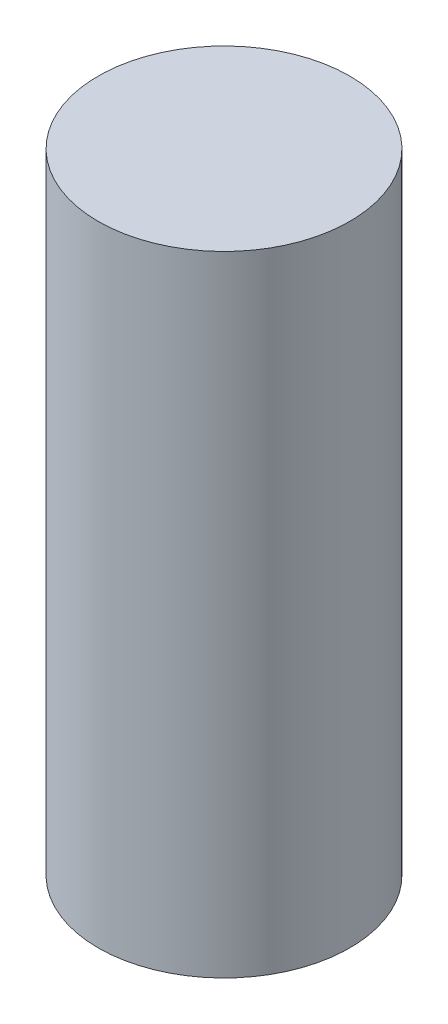
from build123d import *

# Parameters (mm, degrees)
SKETCH1_R           = 4
BOSS_EXTRUDE1_DEPTH = 10


with BuildPart() as part:
    # Sketch1 → Boss-Extrude1 (new, symmetric)
    with BuildSketch(Plane(origin=(0, 0, 0), x_dir=(1, 0, 0), z_dir=(0, 1, 0))):
        with Locations(Location((0, 0, 0), (0, 0, 270))):
            Circle(SKETCH1_R)
    extrude(amount=BOSS_EXTRUDE1_DEPTH, both=True)


solid = part.part
